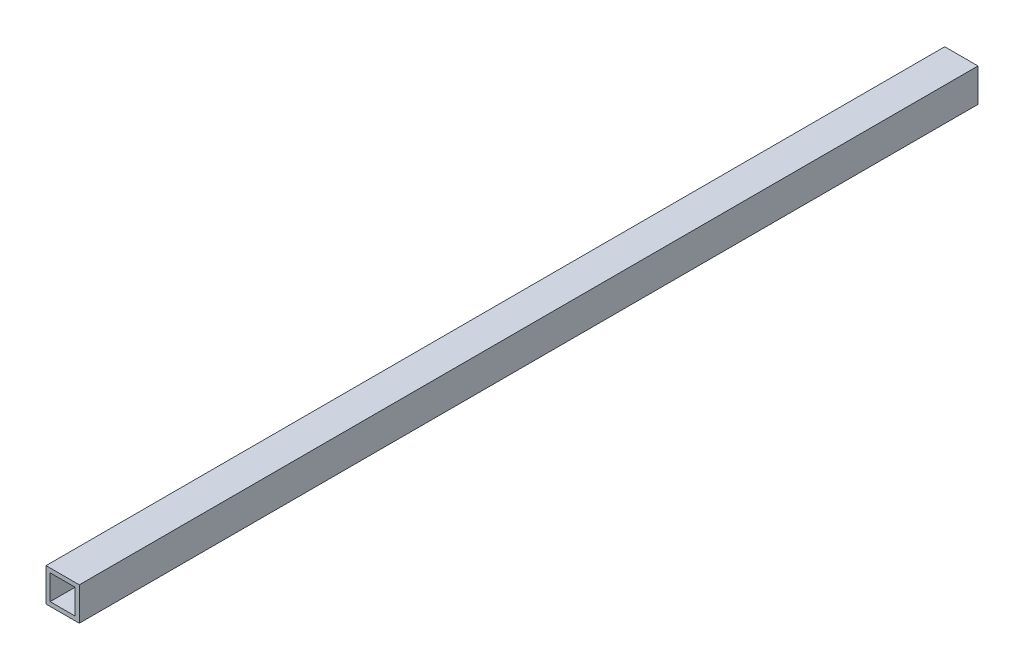
from build123d import *

# Parameters (mm, degrees)
SKETCH1_W           = 25.4
SKETCH1_H           = 25.4
SKETCH1_W_2         = 19.05
SKETCH1_H_2         = 19.05
BOSS_EXTRUDE1_DEPTH = 685.8


with BuildPart() as part:
    # Sketch1 → Boss-Extrude1 (new body)
    with BuildSketch(Plane.XY):
        with Locations((3.05078858, 1.998217396)):
            Rectangle(SKETCH1_W, SKETCH1_H)
        with Locations((3.05078858, 1.998217396)):
            Rectangle(SKETCH1_W_2, SKETCH1_H_2, mode=Mode.SUBTRACT)
    extrude(amount=BOSS_EXTRUDE1_DEPTH)


solid = part.part
